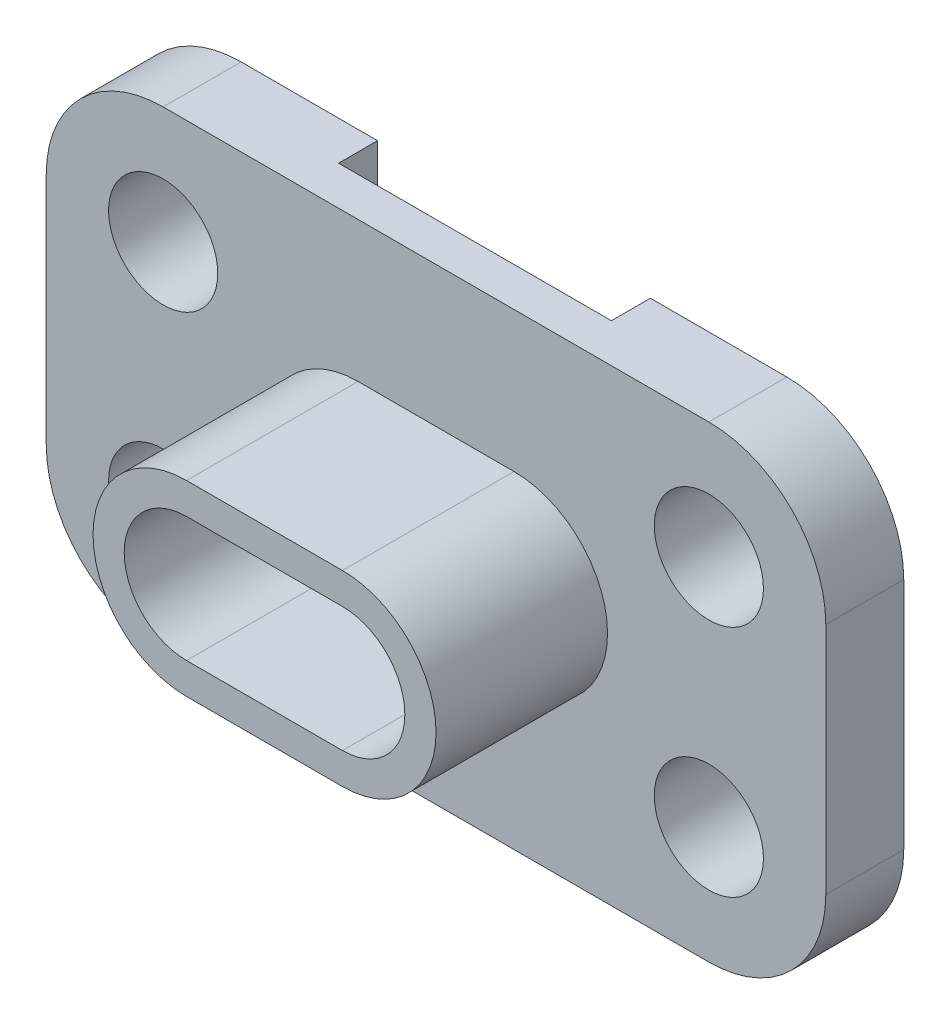
from build123d import *

# Parameters (mm, degrees)
BOSS_EXTRUDE1_DEPTH = 10
CUT_EXTRUDE1_REACH  = 80.74
SKETCH2_W           = 35
SKETCH2_H           = 5
CUT_EXTRUDE2_REACH  = 61.161
SKETCH3_R           = 7
BOSS_EXTRUDE2_DEPTH = 22
CUT_EXTRUDE3_DEPTH  = 22


with BuildPart() as part:
    # Sketch1 → Boss-Extrude1 (new body)
    with BuildSketch(Plane.XY):
        with BuildLine():
            Line((-35, 30), (35, 30))
            ThreePointArc((35, 30), (45.606601718, 25.606601718), (50, 15))
            Line((50, 15), (50, -15))
            ThreePointArc((50, -15), (45.606601718, -25.606601718), (35, -30))
            Line((35, -30), (-35, -30))
            ThreePointArc((-35, -30), (-45.606601718, -25.606601718), (-50, -15))
            Line((-50, -15), (-50, 15))
            ThreePointArc((-50, 15), (-45.606601718, 25.606601718), (-35, 30))
        make_face()
    extrude(amount=BOSS_EXTRUDE1_DEPTH)

    # Sketch2 → Cut-Extrude1 (cut, up to next)
    with BuildSketch(Plane.XZ.offset(30), mode=Mode.PRIVATE) as cut_extrude1_sk1:
        with Locations((0, 2.5)):
            Rectangle(SKETCH2_W, SKETCH2_H)
    cut_extrude1_tool1 = extrude(cut_extrude1_sk1.sketch, amount=-CUT_EXTRUDE1_REACH, mode=Mode.PRIVATE) & part.part
    add(cut_extrude1_tool1.solids().sort_by_distance((0, -30, 2.5))[0], mode=Mode.SUBTRACT)

    # Sketch3 → Cut-Extrude2 (cut, up to next)
    with BuildSketch(Plane.XY.offset(10), mode=Mode.PRIVATE) as cut_extrude2_sk1:
        with Locations((-35, 15)):
            Circle(SKETCH3_R)
    cut_extrude2_tool1 = extrude(cut_extrude2_sk1.sketch, amount=-CUT_EXTRUDE2_REACH, mode=Mode.PRIVATE) & part.part
    # Sketch3 → Cut-Extrude2 (cut, up to next)
    with BuildSketch(Plane.XY.offset(10), mode=Mode.PRIVATE) as cut_extrude2_sk2:
        with Locations((35, 15)):
            Circle(SKETCH3_R)
    cut_extrude2_tool2 = extrude(cut_extrude2_sk2.sketch, amount=-CUT_EXTRUDE2_REACH, mode=Mode.PRIVATE) & part.part
    # Sketch3 → Cut-Extrude2 (cut, up to next)
    with BuildSketch(Plane.XY.offset(10), mode=Mode.PRIVATE) as cut_extrude2_sk3:
        with Locations((35, -15)):
            Circle(SKETCH3_R)
    cut_extrude2_tool3 = extrude(cut_extrude2_sk3.sketch, amount=-CUT_EXTRUDE2_REACH, mode=Mode.PRIVATE) & part.part
    # Sketch3 → Cut-Extrude2 (cut, up to next)
    with BuildSketch(Plane.XY.offset(10), mode=Mode.PRIVATE) as cut_extrude2_sk4:
        with Locations((-35, -15)):
            Circle(SKETCH3_R)
    cut_extrude2_tool4 = extrude(cut_extrude2_sk4.sketch, amount=-CUT_EXTRUDE2_REACH, mode=Mode.PRIVATE) & part.part
    add(cut_extrude2_tool1.solids().sort_by_distance((-35, 15, 10))[0], mode=Mode.SUBTRACT)
    add(cut_extrude2_tool2.solids().sort_by_distance((35, 15, 10))[0], mode=Mode.SUBTRACT)
    add(cut_extrude2_tool3.solids().sort_by_distance((35, -15, 10))[0], mode=Mode.SUBTRACT)
    add(cut_extrude2_tool4.solids().sort_by_distance((-35, -15, 10))[0], mode=Mode.SUBTRACT)

    # Sketch4 → Boss-Extrude2 (add)
    with BuildSketch(Plane.XY.offset(10)):
        with BuildLine():
            Line((-10, 12), (10, 12))
            ThreePointArc((10, 12), (22, 0), (10, -12))
            Line((10, -12), (-10, -12))
            ThreePointArc((-10, -12), (-22, 0), (-10, 12))
        make_face()
    extrude(amount=BOSS_EXTRUDE2_DEPTH)

    # Sketch5 → Cut-Extrude3 (cut)
    with BuildSketch(Plane.XY.offset(32)):
        with BuildLine():
            Line((-10, 8), (10, 8))
            ThreePointArc((10, 8), (18, 0), (10, -8))
            Line((10, -8), (-10, -8))
            ThreePointArc((-10, -8), (-18, 0), (-10, 8))
        make_face()
    extrude(amount=-CUT_EXTRUDE3_DEPTH, mode=Mode.SUBTRACT)


solid = part.part
